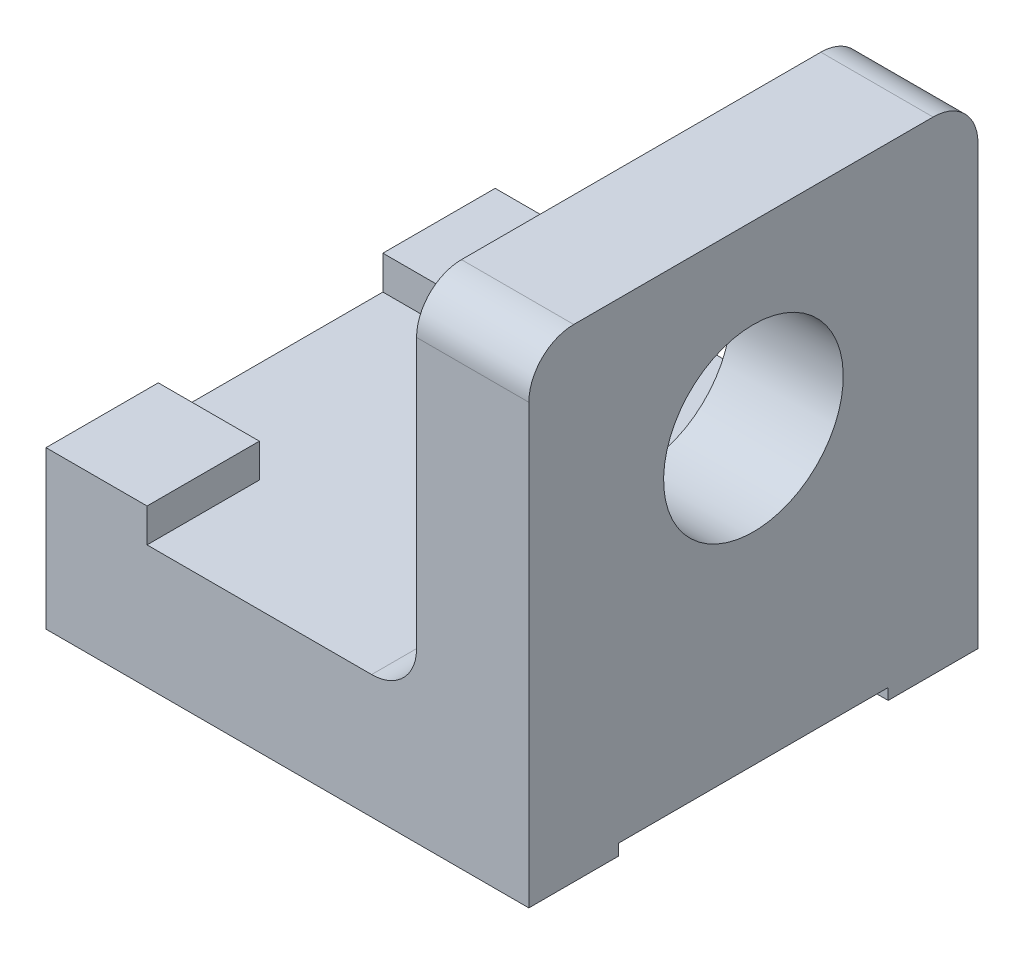
from build123d import *

# Parameters (mm, degrees)
BOSS_EXTRUDE1_DEPTH = 127
SKETCH2_R           = 25.4
CUT_EXTRUDE1_DEPTH  = 127
SKETCH3_W           = 76.2
SKETCH3_H           = 3.175
CUT_EXTRUDE2_DEPTH  = 199.564459386
SKETCH4_W           = 63.5
SKETCH4_H           = 9.525
CUT_EXTRUDE4_DEPTH  = 50.038
FILLET1_R           = 12.7


with BuildPart() as part:
    # Sketch1 → Boss-Extrude1 (new body)
    with BuildSketch(Plane.XY):
        Polygon((196.297790454, 68.2625), (196.297790454, -68.2625), (59.772790454, -68.2625), (59.772790454, -23.8125), (88.347790454, -23.8125), (88.347790454, -33.3375), (164.547790454, -33.3375), (164.547790454, 68.2625), align=None)
    extrude(amount=BOSS_EXTRUDE1_DEPTH)

    # Sketch2 → Cut-Extrude1 (cut)
    with BuildSketch(Plane(origin=(196.297790454, 0, 0), x_dir=(0, 0, -1), z_dir=(1, 0, 0))):
        with Locations(Location((-63.5, 17.4625, 0), (0, 0, 90))):
            Circle(SKETCH2_R)
    extrude(amount=-CUT_EXTRUDE1_DEPTH, mode=Mode.SUBTRACT)

    # Sketch3 → Cut-Extrude2 (cut, through all)
    with BuildSketch(Plane.ZY.offset(-59.772790454)):
        with Locations((63.5, -66.675)):
            Rectangle(SKETCH3_W, SKETCH3_H)
    extrude(amount=-CUT_EXTRUDE2_DEPTH, mode=Mode.SUBTRACT)

    # Sketch4 → Cut-Extrude4 (cut)
    with BuildSketch(Plane.ZY.offset(-59.772790454)):
        with Locations((63.5, -28.575)):
            Rectangle(SKETCH4_W, SKETCH4_H)
    extrude(amount=-CUT_EXTRUDE4_DEPTH, mode=Mode.SUBTRACT)

    # Fillet1
    fillet1_edges = [part.edges().sort_by_distance(p)[0] for p in [
        (180.422790454, 68.2625, 0),
        (164.547790454, -33.3375, 63.5),
        (180.422790454, 68.2625, 127),
    ]]
    fillet(fillet1_edges, radius=FILLET1_R)


solid = part.part
